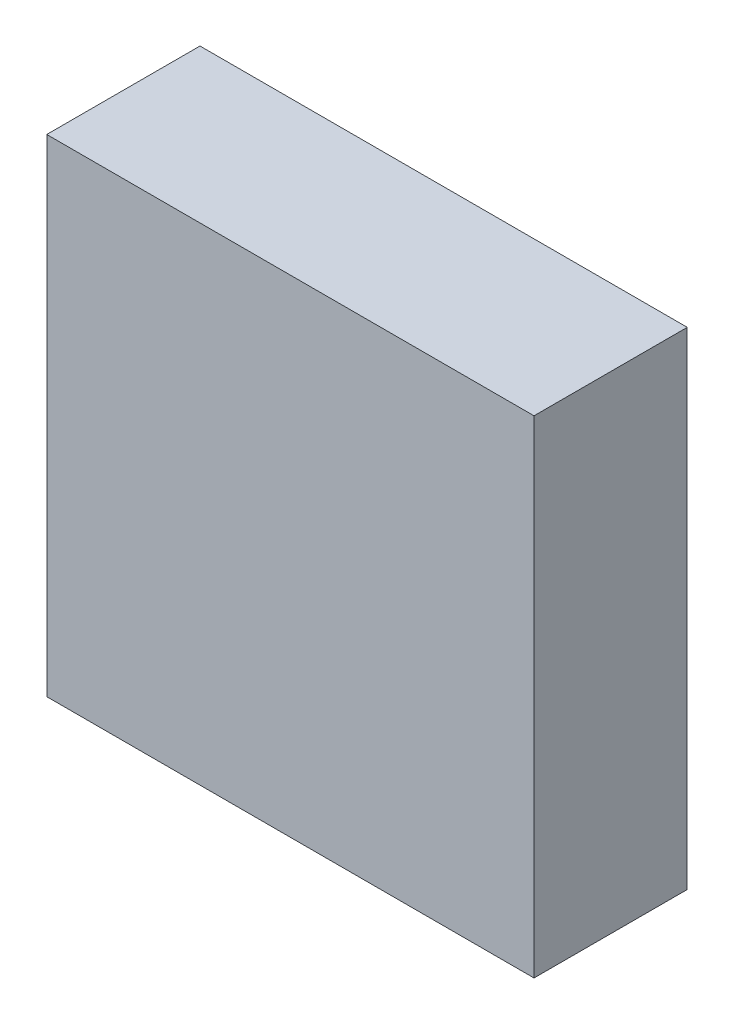
from build123d import *

# Parameters (mm, degrees)
SKETCH1_W               = 3.18
SKETCH1_H               = 3.1775
COMPONENT_OUTLINE_DEPTH = 1


with BuildPart() as part:
    # Sketch1 → Component_Outline (new body)
    with BuildSketch(Plane.XY):
        with Locations((0, 0.00125)):
            Rectangle(SKETCH1_W, SKETCH1_H)
    extrude(amount=COMPONENT_OUTLINE_DEPTH)


solid = part.part
